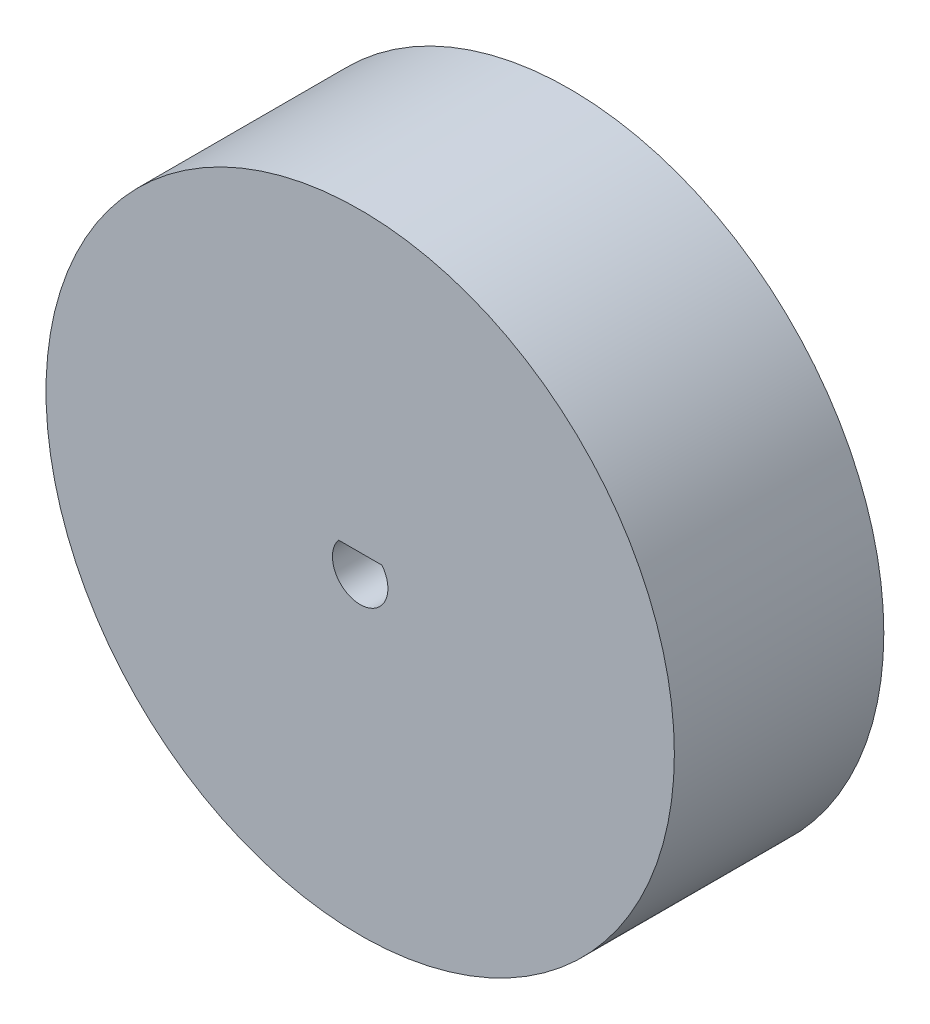
from build123d import *

# Parameters (mm, degrees)
SKETCH1_R           = 30
BOSS_EXTRUDE1_DEPTH = 20
CUT_EXTRUDE1_DEPTH  = 47.904157598


with BuildPart() as part:
    # Sketch1 → Boss-Extrude1 (new body)
    with BuildSketch(Plane.XY):
        Circle(SKETCH1_R)
    extrude(amount=BOSS_EXTRUDE1_DEPTH)

    # Sketch2 → Cut-Extrude1 (cut, through all)
    with BuildSketch(Plane.XY.offset(20)):
        with BuildLine():
            Line((-2.073644135, 1.65), (2.073644135, 1.65))
            ThreePointArc((2.073644135, 1.65), (0, -2.65), (-2.073644135, 1.65))
        make_face()
    extrude(amount=-CUT_EXTRUDE1_DEPTH, mode=Mode.SUBTRACT)


solid = part.part
